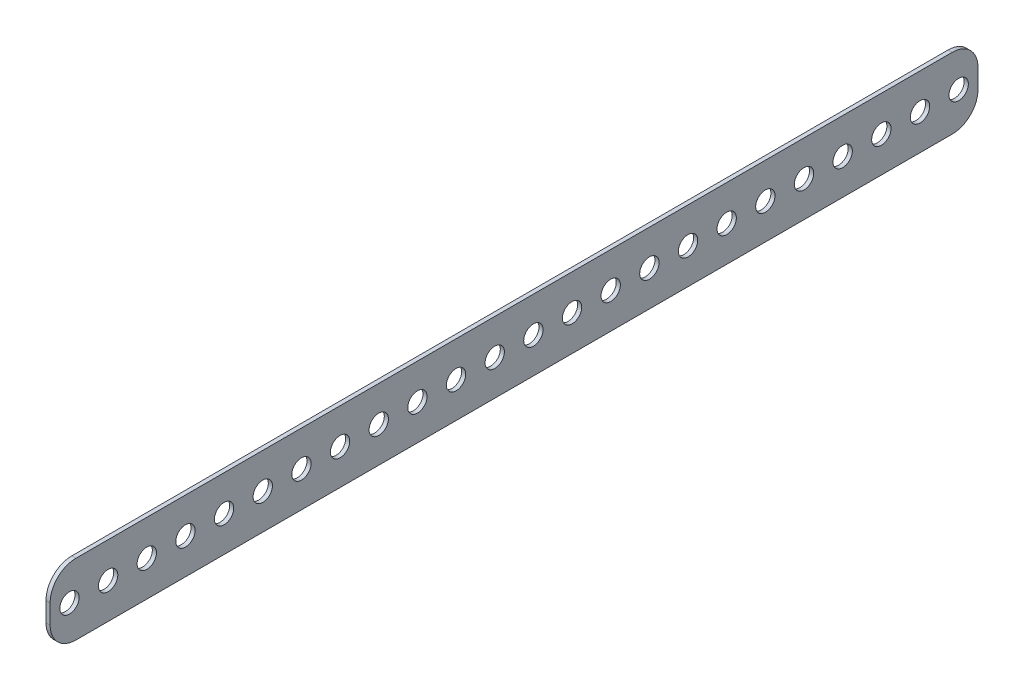
from build123d import *

# Parameters (mm, degrees)
SKETCH1_W           = 2.032
SKETCH1_H           = 34.925
BOSS_EXTRUDE1_DEPTH = 228.6
CUT_EXTRUDE1_REACH  = 233.261
SKETCH2_R           = 4.7625
LPATTERN1_COUNT     = 24
LPATTERN1_PITCH     = 19.05
FILLET1_R           = 12.7


with BuildPart() as part:
    # Sketch1 → Boss-Extrude1 (new, symmetric)
    with BuildSketch(Plane.XY):
        with Locations((1.016, 17.4625)):
            Rectangle(SKETCH1_W, SKETCH1_H)
    extrude(amount=BOSS_EXTRUDE1_DEPTH, both=True)

    # Sketch2 → Cut-Extrude1 (cut, up to next)
    with BuildSketch(Plane.ZY, mode=Mode.PRIVATE) as cut_extrude1_sk1:
        with Locations((219.075, 17.4625)):
            Circle(SKETCH2_R)
    cut_extrude1_tool1 = extrude(cut_extrude1_sk1.sketch, amount=-CUT_EXTRUDE1_REACH, mode=Mode.PRIVATE) & part.part
    cut_extrude1 = cut_extrude1_tool1.solids().sort_by_distance((0, 17.4625, 219.075))[0]
    add(cut_extrude1, mode=Mode.SUBTRACT)

    # LPattern1: Cut-Extrude1 ×24
    with Locations(*[(0, 0, -i * LPATTERN1_PITCH) for i in range(1, LPATTERN1_COUNT)]):
        add(cut_extrude1, mode=Mode.SUBTRACT)

    # Fillet1
    fillet1_edges = [part.edges().sort_by_distance(p)[0] for p in [
        (1.016, 34.925, 228.6),
        (1.016, 34.925, -228.6),
        (1.016, 0, -228.6),
        (1.016, 0, 228.6),
    ]]
    fillet(fillet1_edges, radius=FILLET1_R)


solid = part.part
